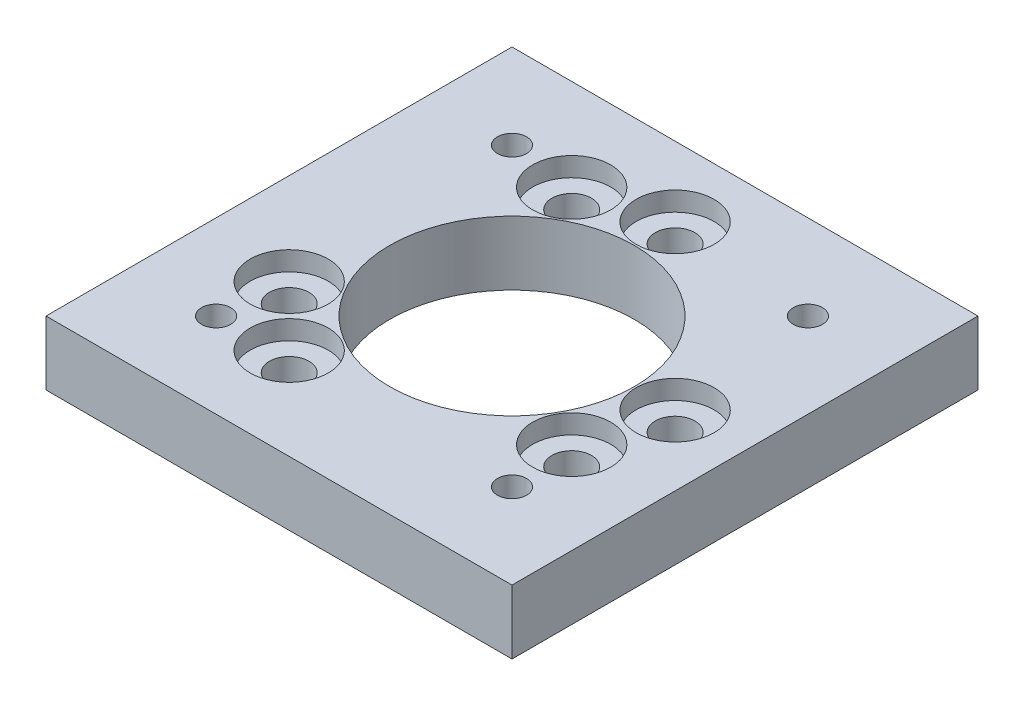
from build123d import *

# Parameters (mm, degrees)
SKETCH1_W                      = 40
SKETCH1_H                      = 40
BOSS_EXTRUDE1_DEPTH            = 5.5
CUT_EXTRUDE1_REACH             = 30.814
SKETCH2_R                      = 10.5
M3X0_5_TAPPED_HOLE1_D          = 2.5
M3X0_5_TAPPED_HOLE1_DEPTH      = 15.24
M3X0_5_TAPPED_HOLE1_TIP        = 0.751075774
CBORE_FOR_M3_SBHCS1_AT_2_COUNT = 2
CBORE_FOR_M3_SBHCS1_AT_2_PITCH = 7.246933263
CIRPATTERN1_COUNT              = 3


with BuildPart() as part:
    # Sketch1 → Boss-Extrude1 (new body)
    with BuildSketch(Plane(origin=(0, 0, 0), x_dir=(1, 0, 0), z_dir=(0, 1, 0))):
        Rectangle(SKETCH1_W, SKETCH1_H)
    extrude(amount=BOSS_EXTRUDE1_DEPTH)

    # Sketch2 → Cut-Extrude1 (cut, up to next)
    with BuildSketch(Plane(origin=(0, 5.5, 0), x_dir=(1, 0, 0), z_dir=(0, 1, 0)), mode=Mode.PRIVATE) as cut_extrude1_sk1:
        with Locations(Location((0, 0, 0), (0, 0, 270))):
            Circle(SKETCH2_R)
    cut_extrude1_tool1 = extrude(cut_extrude1_sk1.sketch, amount=-CUT_EXTRUDE1_REACH, mode=Mode.PRIVATE) & part.part
    add(cut_extrude1_tool1.solids().sort_by_distance((0, 5.5, 0))[0], mode=Mode.SUBTRACT)

    # M3x0.5 Tapped Hole1
    with Locations(Plane(origin=(0, 5.5, 0), x_dir=(1, 0, 0), z_dir=(0, 1, 0))):
        with Locations((-12.7, -12.7), (-12.7, 12.7), (12.7, 12.7), (12.7, -12.7)):
            Hole(M3X0_5_TAPPED_HOLE1_D / 2, depth=M3X0_5_TAPPED_HOLE1_DEPTH)
            with Locations((0, 0, -(M3X0_5_TAPPED_HOLE1_DEPTH + M3X0_5_TAPPED_HOLE1_TIP / 2))):  # 118° drill point
                Cone(0, M3X0_5_TAPPED_HOLE1_D / 2, M3X0_5_TAPPED_HOLE1_TIP, mode=Mode.SUBTRACT)

    # Sketch10 → CBORE for M3 SBHCS1 (revolve, cut)
    with BuildSketch(Plane(origin=(-12.124355653, 5.5, 7), x_dir=(0, 0, 1), z_dir=(1, 0, 0))):
        Polygon((0, 0), (0, 16.261463052), (1.7, 15.24), (1.7, 1.65), (3.35, 1.65), (3.35, 0), align=None)
    cbore_for_m3_sbhcs1 = revolve(axis=Axis((-12.124355653, 11.85, 7), (0, -1, 0)), mode=Mode.SUBTRACT)

    # CBORE for M3 SBHCS1 at 2: CBORE for M3 SBHCS1 ×2
    with Locations(*[Vector(0.7071067811865501, 0, 0.7071067811865449) * (i * CBORE_FOR_M3_SBHCS1_AT_2_PITCH) for i in range(1, CBORE_FOR_M3_SBHCS1_AT_2_COUNT)]):
        add(cbore_for_m3_sbhcs1, mode=Mode.SUBTRACT)

    # CirPattern1: CBORE for M3 SBHCS1 ×3 about axis
    cirpattern1_axis = Axis((0, 0, 0), (0, 1, 0))
    for i in range(1, CIRPATTERN1_COUNT):
        add(cbore_for_m3_sbhcs1.rotate(cirpattern1_axis, i * 360 / CIRPATTERN1_COUNT), mode=Mode.SUBTRACT)

    # CirPattern1 copy 1 sketch → CirPattern1 copy 1 (revolve, cut)
    with BuildSketch(Plane(origin=(14, 5.5, 0), x_dir=(0.8660254037844387, 0, -0.4999999999999998), z_dir=(-0.4999999999999998, 0, -0.8660254037844387))):
        Polygon((0, 0), (0, 16.261463052), (1.7, 15.24), (1.7, 1.65), (3.35, 1.65), (3.35, 0), align=None)
    revolve(axis=Axis((14, 11.85, 0), (0, -1, 0)), mode=Mode.SUBTRACT)

    # CirPattern1 copy 2 sketch → CirPattern1 copy 2 (revolve, cut)
    with BuildSketch(Plane(origin=(-7, 5.5, -12.124355653), x_dir=(-0.8660254037844384, 0, -0.5000000000000004), z_dir=(-0.5000000000000004, 0, 0.8660254037844384))):
        Polygon((0, 0), (0, 16.261463052), (1.7, 15.24), (1.7, 1.65), (3.35, 1.65), (3.35, 0), align=None)
    revolve(axis=Axis((-7, 11.85, -12.124355653), (0, -1, 0)), mode=Mode.SUBTRACT)


solid = part.part
